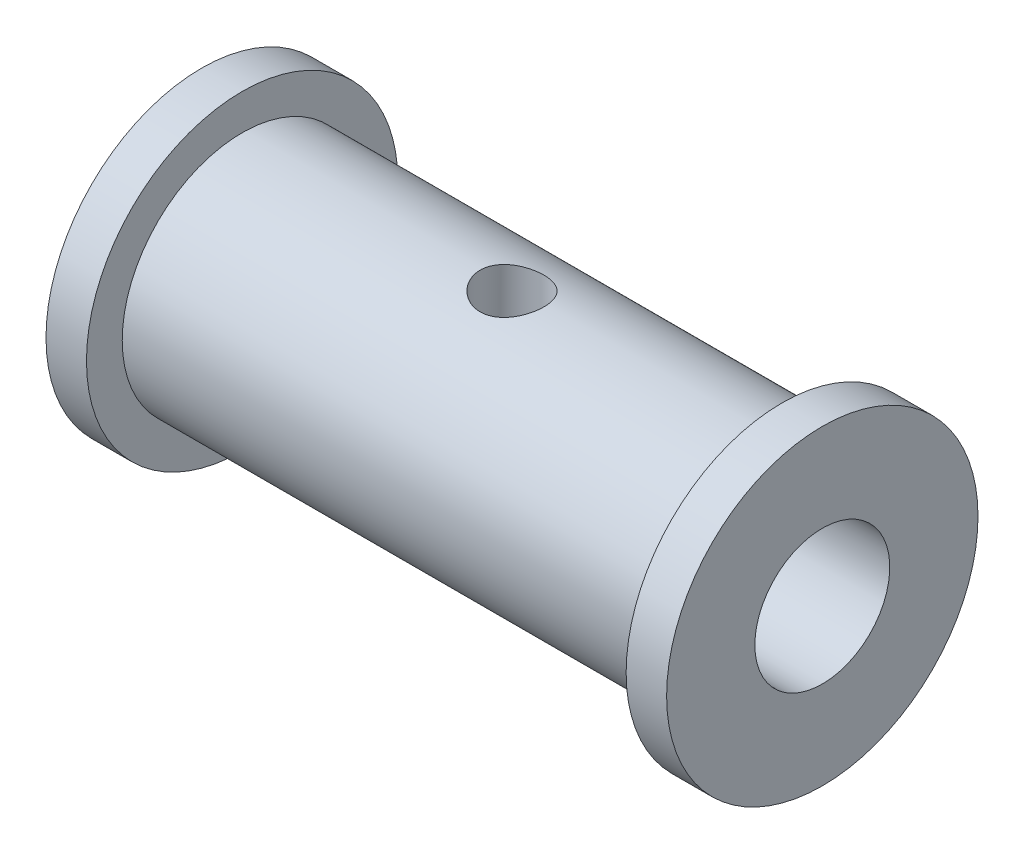
from build123d import *

# Parameters (mm, degrees)
SKETCH2_R          = 1.5
CUT_EXTRUDE1_DEPTH = 18.908161877


with BuildPart() as part:
    # Sketch1 → Revolve1 (revolve)
    with BuildSketch(Plane.XY):
        Polygon((14.605, 3.175), (14.605, 7.3279), (12.7, 7.3279), (12.7, 5.64515), (-12.7, 5.64515), (-12.7, 7.3279), (-14.605, 7.3279), (-14.605, 3.175), align=None)
    revolve(axis=Axis((-15.275524476, 0, 0), (1, 0, 0)))

    # Sketch2 → Cut-Extrude1 (cut, through all)
    with BuildSketch(Plane(origin=(0, 0, 0), x_dir=(1, 0, 0), z_dir=(0, 1, 0))):
        Circle(SKETCH2_R)
    extrude(amount=CUT_EXTRUDE1_DEPTH, mode=Mode.SUBTRACT)


solid = part.part
